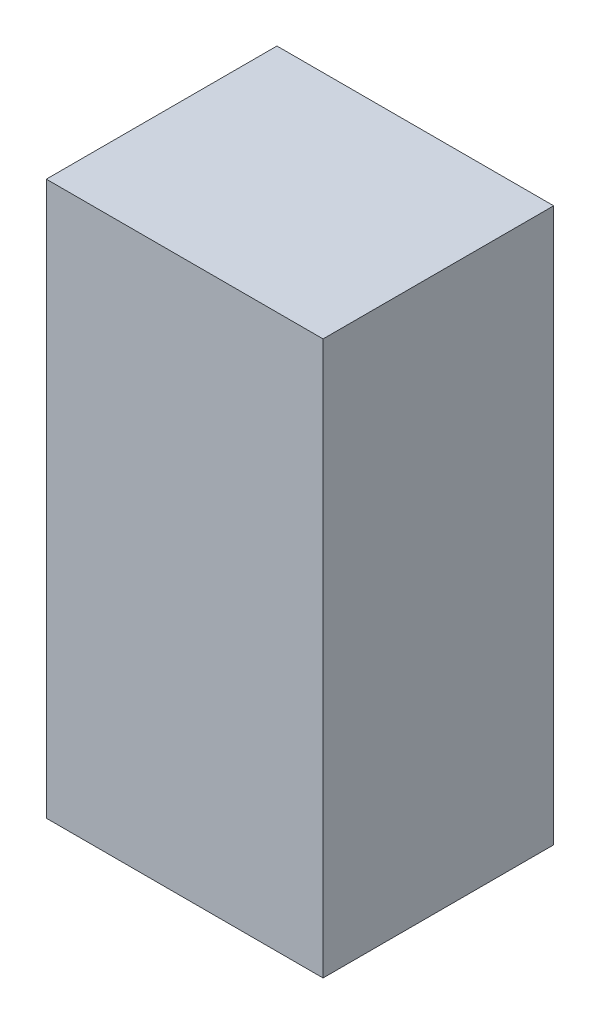
from build123d import *

# Parameters (mm, degrees)
BOSS_EXTRUDE1_START = -500
SKETCH1_W           = 1200
SKETCH1_H           = 2400
BOSS_EXTRUDE1_DEPTH = 1000


with BuildPart() as part:
    # Sketch1 → Boss-Extrude1 (new body)
    with BuildSketch(Plane.XY.offset(BOSS_EXTRUDE1_START)):
        Rectangle(SKETCH1_W, SKETCH1_H)
    extrude(amount=BOSS_EXTRUDE1_DEPTH)


solid = part.part
